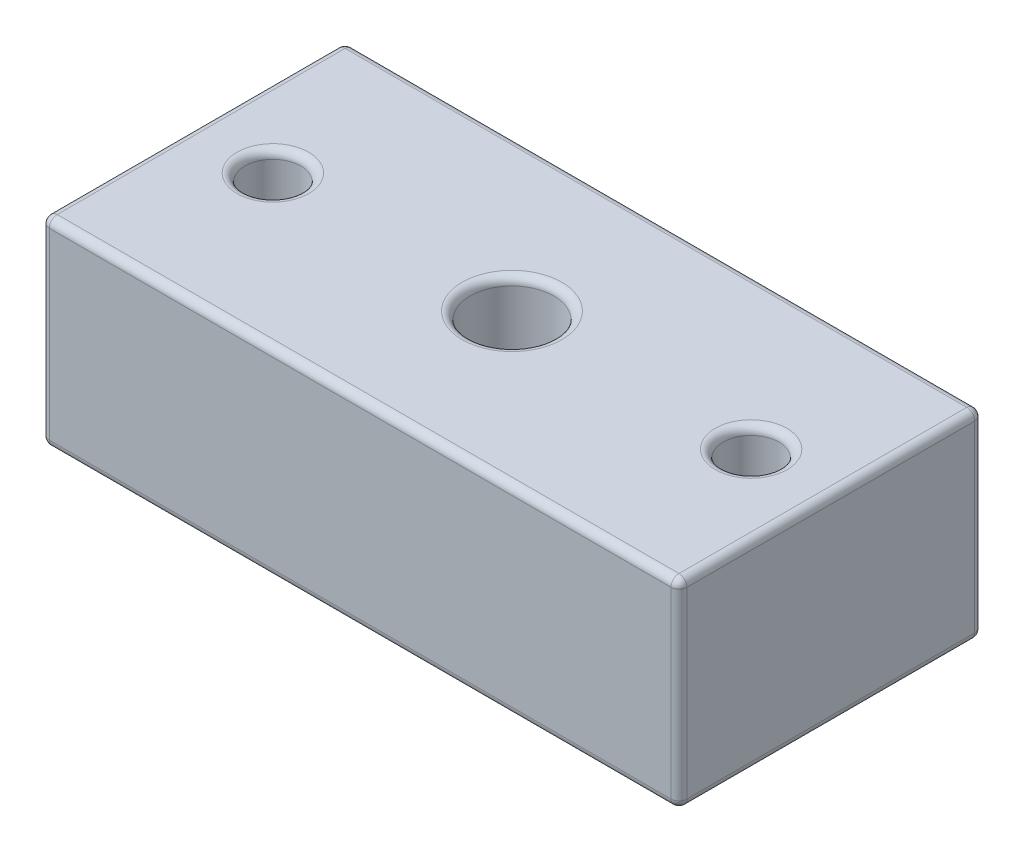
from build123d import *

# Parameters (mm, degrees)
SKETCH1_W           = 80
SKETCH1_H           = 38.1
SKETCH1_R           = 5
SKETCH1_R_2         = 10.5
SKETCH1_R_3         = 3.5
BOSS_EXTRUDE1_DEPTH = 20
BOSS_EXTRUDE2_START = 10
SKETCH1_4_R         = 10.5
SKETCH1_4_R_2       = 5.25
BOSS_EXTRUDE2_DEPTH = 10
BOSS_EXTRUDE4_START = -5
SKETCH1_6_W         = 80
SKETCH1_6_H         = 38.1
SKETCH1_6_R         = 5
SKETCH1_6_R_2       = 10.5
SKETCH1_6_R_3       = 3.5
BOSS_EXTRUDE4_DEPTH = 5
FILLET2_R           = 1
SKETCH3_R           = 3.5
CUT_EXTRUDE1_DEPTH  = 10


with BuildPart() as part:
    # Sketch1 → Boss-Extrude1 (new body)
    # profile 1 of 3: a face of its own
    with BuildSketch(Plane(origin=(0, 0, 0), x_dir=(1, 0, 0), z_dir=(0, 1, 0))):
        with Locations((40, -19.05)):
            Rectangle(SKETCH1_W, SKETCH1_H)
        with Locations((70, -19.05)):
            Circle(SKETCH1_R, mode=Mode.SUBTRACT)
        with Locations((10, -19.05)):
            Circle(SKETCH1_R, mode=Mode.SUBTRACT)
        with Locations(Location((40, -19.05, 0), (0, 0, 270))):
            Circle(SKETCH1_R_2, mode=Mode.SUBTRACT)
    # profile 2 of 3: a face of its own
    with BuildSketch(Plane(origin=(0, 0, 0), x_dir=(1, 0, 0), z_dir=(0, 1, 0))):
        with Locations((10, -19.05)):
            Circle(SKETCH1_R)
        with Locations(Location((10, -19.05, 0), (0, 0, 270))):
            Circle(SKETCH1_R_3, mode=Mode.SUBTRACT)
    # profile 3 of 3: a face of its own
    with BuildSketch(Plane(origin=(0, 0, 0), x_dir=(1, 0, 0), z_dir=(0, 1, 0))):
        with Locations((70, -19.05)):
            Circle(SKETCH1_R)
        with Locations(Location((70, -19.05, 0), (0, 0, 270))):
            Circle(SKETCH1_R_3, mode=Mode.SUBTRACT)
    extrude(amount=BOSS_EXTRUDE1_DEPTH)

    # Sketch1<4> → Boss-Extrude2 (add)
    with BuildSketch(Plane(origin=(0, 0, 0), x_dir=(1, 0, 0), z_dir=(0, 1, 0)).offset(BOSS_EXTRUDE2_START)):
        with Locations(Location((40, -19.05, 0), (0, 0, 270))):
            Circle(SKETCH1_4_R)
        with Locations(Location((40, -19.05, 0), (0, 0, 270))):
            Circle(SKETCH1_4_R_2, mode=Mode.SUBTRACT)
    extrude(amount=BOSS_EXTRUDE2_DEPTH)

    # Sketch1<6> → Boss-Extrude4 (add)
    # profile 1 of 3: a face of its own
    with BuildSketch(Plane(origin=(0, 0, 0), x_dir=(1, 0, 0), z_dir=(0, 1, 0)).offset(BOSS_EXTRUDE4_START)):
        with Locations((40, -19.05)):
            Rectangle(SKETCH1_6_W, SKETCH1_6_H)
        with Locations((70, -19.05)):
            Circle(SKETCH1_6_R, mode=Mode.SUBTRACT)
        with Locations((10, -19.05)):
            Circle(SKETCH1_6_R, mode=Mode.SUBTRACT)
        with Locations(Location((40, -19.05, 0), (0, 0, 270))):
            Circle(SKETCH1_6_R_2, mode=Mode.SUBTRACT)
    # profile 2 of 3: a face of its own
    with BuildSketch(Plane(origin=(0, 0, 0), x_dir=(1, 0, 0), z_dir=(0, 1, 0)).offset(BOSS_EXTRUDE4_START)):
        with Locations((70, -19.05)):
            Circle(SKETCH1_6_R)
        with Locations(Location((70, -19.05, 0), (0, 0, 270))):
            Circle(SKETCH1_6_R_3, mode=Mode.SUBTRACT)
    # profile 3 of 3: a face of its own
    with BuildSketch(Plane(origin=(0, 0, 0), x_dir=(1, 0, 0), z_dir=(0, 1, 0)).offset(BOSS_EXTRUDE4_START)):
        with Locations((10, -19.05)):
            Circle(SKETCH1_6_R)
        with Locations(Location((10, -19.05, 0), (0, 0, 270))):
            Circle(SKETCH1_6_R_3, mode=Mode.SUBTRACT)
    extrude(amount=BOSS_EXTRUDE4_DEPTH)

    # Fillet2
    fillet2_edges = [part.edges().sort_by_distance(p)[0] for p in [
        (80, 20, 19.05),
        (80, 7.5, 38.1),
        (0, 7.5, 38.1),
        (0, 7.5, 0),
        (80, 7.5, 0),
        (40, 20, 0),
        (0, 20, 19.05),
        (40, 20, 13.8),
        (40, 20, 38.1),
        (40, -5, 38.1),
        (0, -5, 19.05),
        (40, -5, 8.55),
        (10, 20, 15.55),
        (80, -5, 19.05),
        (40, -5, 0),
        (70, 20, 15.55),
    ]]
    fillet(fillet2_edges, radius=FILLET2_R)

    # Sketch3 → Cut-Extrude1 (cut)
    with BuildSketch(Plane.XY):
        with Locations((40, 5.5)):
            Circle(SKETCH3_R)
        with Locations((40, 2)):
            Circle(SKETCH3_R)
        with BuildLine():
            ThreePointArc((43.031088913, 3.75), (43.380740392, 2.905866658), (43.5, 2))
            Line((43.5, 2), (43.5, 5.5))
            ThreePointArc((43.5, 5.5), (43.380740392, 4.594133342), (43.031088913, 3.75))
        make_face()
        with BuildLine():
            Line((36.5, 5.5), (36.5, 2))
            ThreePointArc((36.5, 2), (36.619259608, 2.905866658), (36.968911087, 3.75))
            ThreePointArc((36.968911087, 3.75), (36.619259608, 4.594133342), (36.5, 5.5))
        make_face()
    extrude(amount=CUT_EXTRUDE1_DEPTH, mode=Mode.SUBTRACT)


solid = part.part
